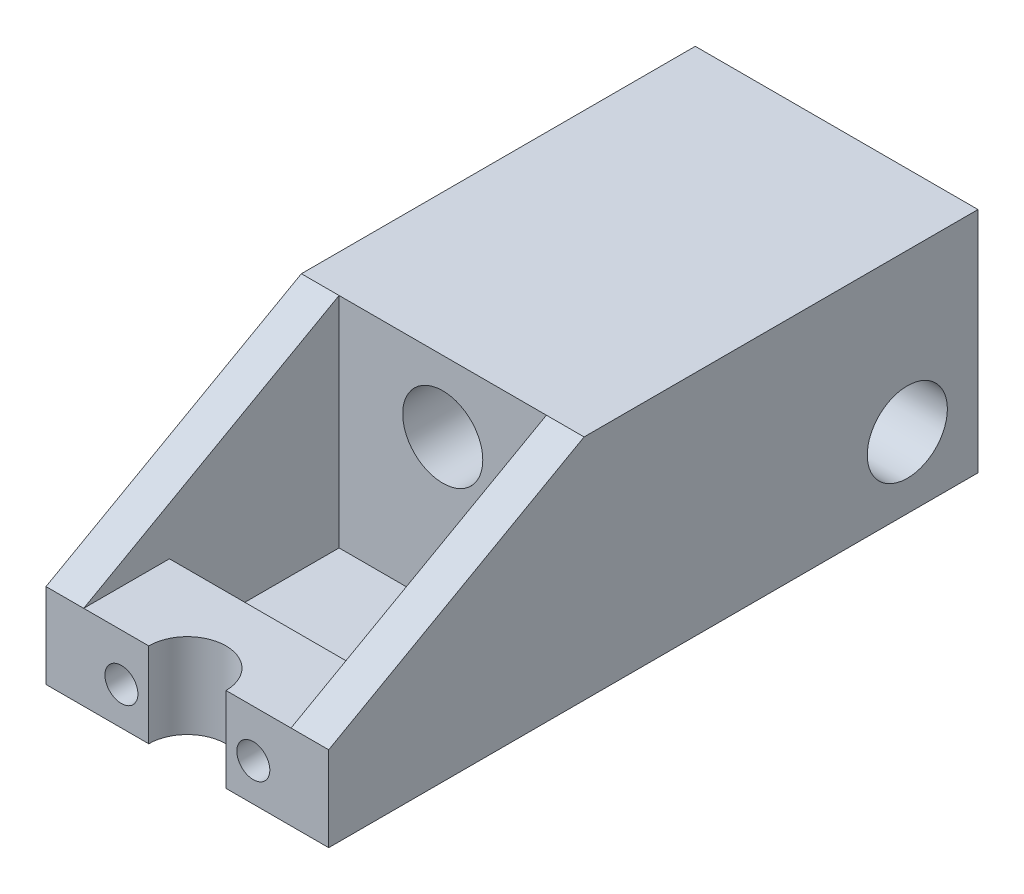
from build123d import *

# Parameters (mm, degrees)
SCHIZZO7_W                   = 30
SCHIZZO7_H                   = 24.2
SCHIZZO7_R                   = 4.25
ESTRUSIONE_ESTRUSIONE3_DEPTH = 7.5
TAGLIO_ESTRUSIONE1_REACH     = 35.206
SCHIZZO8_R                   = 4.25
SCHIZZO12_W                  = 30
SCHIZZO12_H                  = 9
ESTRUSIONE_ESTRUSIONE5_DEPTH = 53.9
TAGLIO_ESTRUSIONE3_REACH     = 67.008
SCHIZZO15_W                  = 22
SCHIZZO15_H                  = 18
TAGLIO_ESTRUSIONE4_DEPTH     = 8
TAGLIO_ESTRUSIONE5_REACH     = 73.545
SCHIZZO16_R                  = 1.75
TAGLIO_ESTRUSIONE6_DEPTH     = 3.1
SCHIZZO20_W                  = 30
SCHIZZO20_H                  = 15.2
SCHIZZO20_R                  = 4.25
ESTRUSIONE_ESTRUSIONE6_DEPTH = 26.8
ESTRUSIONE_ESTRUSIONE7_DEPTH = 4
ESTRUSIONE_ESTRUSIONE8_START = -4
ESTRUSIONE_ESTRUSIONE8_DEPTH = 4


with BuildPart() as part:
    # Schizzo7 → Estrusione-Estrusione3 (new, symmetric)
    with BuildSketch(Plane.XY):
        Rectangle(SCHIZZO7_W, SCHIZZO7_H)
        with Locations((0, 4.6)):
            Circle(SCHIZZO7_R, mode=Mode.SUBTRACT)
    extrude(amount=ESTRUSIONE_ESTRUSIONE3_DEPTH, both=True)

    # Schizzo8 → Taglio-Estrusione1 (cut, up to next)
    with BuildSketch(Plane(origin=(15, 0, 0), x_dir=(0, 0, -1), z_dir=(1, 0, 0)), mode=Mode.PRIVATE) as taglio_estrusione1_sk1:
        with Locations((0, -4.6)):
            Circle(SCHIZZO8_R)
    taglio_estrusione1_tool1 = extrude(taglio_estrusione1_sk1.sketch, amount=-TAGLIO_ESTRUSIONE1_REACH, mode=Mode.PRIVATE) & part.part
    add(taglio_estrusione1_tool1.solids().sort_by_distance((15, -4.6, 0))[0], mode=Mode.SUBTRACT)

    # Schizzo12 → Estrusione-Estrusione5 (add)
    with BuildSketch(Plane.XY.offset(7.5)):
        with Locations((0, -7.6)):
            Rectangle(SCHIZZO12_W, SCHIZZO12_H)
    extrude(amount=ESTRUSIONE_ESTRUSIONE5_DEPTH)

    # Schizzo14 → Taglio-Estrusione3 (cut, up to next)
    with BuildSketch(Plane(origin=(0, -3.1, 0), x_dir=(1, 0, 0), z_dir=(0, 1, 0)), mode=Mode.PRIVATE) as taglio_estrusione3_sk1:
        with BuildLine():
            Line((4.1, -61.4), (-4.1, -61.4))
            ThreePointArc((-4.1, -61.4), (0, -57.3), (4.1, -61.4))
        make_face()
    taglio_estrusione3_tool1 = extrude(taglio_estrusione3_sk1.sketch, amount=-TAGLIO_ESTRUSIONE3_REACH, mode=Mode.PRIVATE) & part.part
    add(taglio_estrusione3_tool1.solids().sort_by_distance((0, -3.1, 59.659906))[0], mode=Mode.SUBTRACT)

    # Schizzo15 → Taglio-Estrusione4 (cut)
    with BuildSketch(Plane(origin=(0, -3.1, 0), x_dir=(1, 0, 0), z_dir=(0, 1, 0))):
        with Locations((0, -43.3)):
            Rectangle(SCHIZZO15_W, SCHIZZO15_H)
    extrude(amount=-TAGLIO_ESTRUSIONE4_DEPTH, mode=Mode.SUBTRACT)

    # Schizzo16 → Taglio-Estrusione5 (cut, up to next)
    with BuildSketch(Plane.XY.offset(61.4), mode=Mode.PRIVATE) as taglio_estrusione5_sk1:
        with Locations((-7, -8.1)):
            Circle(SCHIZZO16_R)
    taglio_estrusione5_tool1 = extrude(taglio_estrusione5_sk1.sketch, amount=-TAGLIO_ESTRUSIONE5_REACH, mode=Mode.PRIVATE) & part.part
    # Schizzo16 → Taglio-Estrusione5 (cut, up to next)
    with BuildSketch(Plane.XY.offset(61.4), mode=Mode.PRIVATE) as taglio_estrusione5_sk2:
        with Locations((7, -8.1)):
            Circle(SCHIZZO16_R)
    taglio_estrusione5_tool2 = extrude(taglio_estrusione5_sk2.sketch, amount=-TAGLIO_ESTRUSIONE5_REACH, mode=Mode.PRIVATE) & part.part
    add(taglio_estrusione5_tool1.solids().sort_by_distance((-7, -8.1, 61.4))[0], mode=Mode.SUBTRACT)
    add(taglio_estrusione5_tool2.solids().sort_by_distance((7, -8.1, 61.4))[0], mode=Mode.SUBTRACT)

    # Schizzo17 → Taglio-Estrusione6 (cut)
    with BuildSketch(Plane(origin=(0, 0, 52.3), x_dir=(-1, 0, 0), z_dir=(0, 0, -1))):
        Polygon((-3.75, -8.1), (-5.375, -5.285417438), (-8.625, -5.285417438), (-10.25, -8.1), (-8.625, -10.914582562), (-5.375, -10.914582562), align=None)
        Polygon((5.375, -10.914582562), (3.75, -8.1), (5.375, -5.285417438), (8.625, -5.285417438), (10.25, -8.1), (8.625, -10.914582562), align=None)
    extrude(amount=-TAGLIO_ESTRUSIONE6_DEPTH, mode=Mode.SUBTRACT)

    # Schizzo20 → Estrusione-Estrusione6 (add)
    with BuildSketch(Plane.XY.offset(7.5)):
        with Locations((0, 4.5)):
            Rectangle(SCHIZZO20_W, SCHIZZO20_H)
        with Locations((0, 4.6)):
            Circle(SCHIZZO20_R, mode=Mode.SUBTRACT)
    extrude(amount=ESTRUSIONE_ESTRUSIONE6_DEPTH)

    # Schizzo21 → Estrusione-Estrusione7 (add)
    with BuildSketch(Plane.ZY.offset(15)):
        Polygon((34.3, 12.1), (61.4, -3.1), (34.3, -3.1), align=None)
    extrude(amount=-ESTRUSIONE_ESTRUSIONE7_DEPTH)

    # Schizzo22 → Estrusione-Estrusione8 (add)
    with BuildSketch(Plane(origin=(15, 0, 0), x_dir=(0, 0, -1), z_dir=(1, 0, 0)).offset(ESTRUSIONE_ESTRUSIONE8_START)):
        Polygon((-34.3, 12.1), (-61.4, -3.1), (-34.3, -3.1), align=None)
    extrude(amount=ESTRUSIONE_ESTRUSIONE8_DEPTH)


solid = part.part
